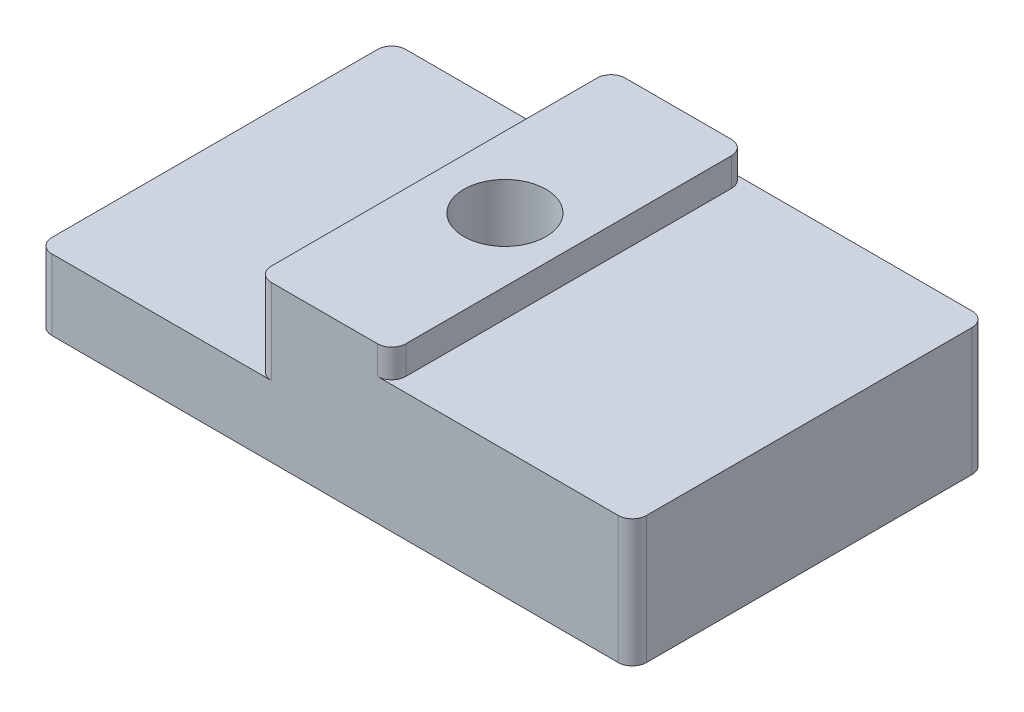
from build123d import *

# Parameters (mm, degrees)
SKETCH1_W            = 45
SKETCH1_H            = 25
BOSS_EXTRUDE1_DEPTH  = 5
SKETCH5_W            = 26.5
SKETCH5_H            = 25
BOSS_EXTRUDE3_DEPTH  = 4
SKETCH11_W           = 9.5
SKETCH11_H           = 25
BOSS_EXTRUDE5_DEPTH  = 2
SKETCH12_W           = 3
SKETCH12_H           = 25
CUT_EXTRUDE2_DEPTH   = 52.826634079
M5_CLEARANCE_HOLE1_D = 5.8
FILLET2_R            = 1


with BuildPart() as part:
    # Sketch1 → Boss-Extrude1 (new body)
    with BuildSketch(Plane(origin=(0, 0, 0), x_dir=(1, 0, 0), z_dir=(0, 1, 0))):
        with Locations((22.5, 12.5)):
            Rectangle(SKETCH1_W, SKETCH1_H)
    extrude(amount=BOSS_EXTRUDE1_DEPTH)

    # Sketch5 → Boss-Extrude3 (add)
    with BuildSketch(Plane(origin=(0, 5, 0), x_dir=(1, 0, 0), z_dir=(0, 1, 0))):
        with Locations((31.75, 12.5)):
            Rectangle(SKETCH5_W, SKETCH5_H)
    extrude(amount=BOSS_EXTRUDE3_DEPTH)

    # Sketch11 → Boss-Extrude5 (add)
    with BuildSketch(Plane(origin=(0, 9, 0), x_dir=(1, 0, 0), z_dir=(0, 1, 0))):
        with Locations((23.25, 12.5)):
            Rectangle(SKETCH11_W, SKETCH11_H)
    extrude(amount=BOSS_EXTRUDE5_DEPTH)

    # Sketch12 → Cut-Extrude2 (cut, through all)
    with BuildSketch(Plane(origin=(0, 5, 0), x_dir=(1, 0, 0), z_dir=(0, 1, 0))):
        with Locations((1.5, 12.5)):
            Rectangle(SKETCH12_W, SKETCH12_H)
    extrude(amount=-CUT_EXTRUDE2_DEPTH, mode=Mode.SUBTRACT)

    # M5 Clearance Hole1 (through all)
    with Locations(Plane(origin=(0, 0, 0), x_dir=(-1, 0, 0), z_dir=(0, -1, 0))):
        with Locations((-23.5, 12.5)):
            Hole(M5_CLEARANCE_HOLE1_D / 2)

    # Fillet2
    fillet2_edges = [part.edges().sort_by_distance(p)[0] for p in [
        (18.5, 8, -25),
        (18.5, 8, 0),
        (28, 10, 0),
        (28, 10, -25),
        (3, 2.5, -25),
        (3, 2.5, 0),
        (45, 4.5, -25),
        (45, 4.5, 0),
    ]]
    fillet(fillet2_edges, radius=FILLET2_R)


solid = part.part
